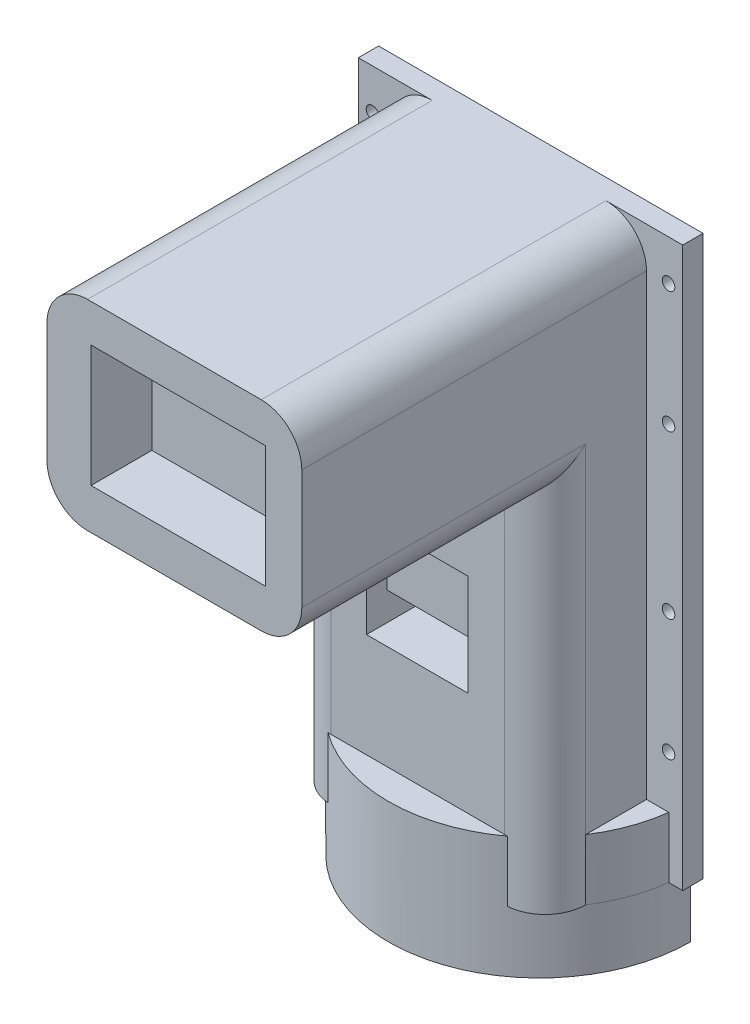
from build123d import *

# Parameters (mm, degrees)
SKETCH_1_W           = 80
SKETCH_1_H           = 156.363783163
EXTRUDE_1_DEPTH      = 90
SKETCH_3_W           = 30
SKETCH_3_H           = 30
CUT_EXTRUDE_1_DEPTH  = 15
SKETCH_4_W           = 182.158516052
SKETCH_4_H           = 121.356957168
CUT_EXTRUDE_2_DEPTH  = 60
SKETCH_6_W           = 50.175493085
SKETCH_6_H           = 149.046749465
CUT_EXTRUDE_4_DEPTH  = 16
SKETCH_7_W           = 13.065428471
SKETCH_7_H           = 30
CUT_EXTRUDE_5_DEPTH  = 147.711160425
SKETCH_8_W           = 28.25361391
SKETCH_8_H           = 169.077909422
CUT_EXTRUDE_6_DEPTH  = 85
SKETCH_10_W          = 25
SKETCH_10_H          = 25
CUT_EXTRUDE_7_DEPTH  = 5
SKETCH_11_W          = 25
SKETCH_11_H          = 7.062774738
CUT_EXTRUDE_8_DEPTH  = 133.850158424
SKETCH_12_R          = 1.553167794
CUT_EXTRUDE_9_DEPTH  = 144.698171851
FILLET_3_R           = 10
CUT_EXTRUDE_START    = 60
SKETCH_15_W          = 25.147195628
SKETCH_15_H          = 171.888478346
CUT_EXTRUDE_10_DEPTH = 85
FILLET_6_R           = 10
FILLET_7_R           = 10
SKETCH_18_W          = 152.348651532
SKETCH_18_H          = 32.578688912
CUT_EXTRUDE_11_DEPTH = 147.711160425
SKETCH_19_R          = 37.254412131
SKETCH_19_R_2        = 32.5
EXTRUDE_3_DEPTH      = 15
SKETCH_20_W          = 127.729938291
SKETCH_20_H          = 42.54840274
CUT_EXTRUDE_12_DEPTH = 185.159311294
EXTRUDE_5_DEPTH      = 15
EXTRUDE_START        = 15
EXTRUDE_6_DEPTH      = 15
EXTRUDE_7_DEPTH      = 15
SKETCH_27_R          = 1.5
CUT_EXTRUDE_13_DEPTH = 10


with BuildPart() as part:
    # 草图1 → 凸台-拉伸1 (new body)
    with BuildSketch(Plane.XY):
        with Locations((-9.441340782, -26.602259963)):
            Rectangle(SKETCH_1_W, SKETCH_1_H)
    extrude(amount=EXTRUDE_1_DEPTH)

    # 草图3 → 切除-拉伸1 (cut)
    with BuildSketch(Plane.XY.offset(90)):
        with Locations((-15.348450006, 27.268684522)):
            Rectangle(SKETCH_3_W, SKETCH_3_H)
    extrude(amount=-CUT_EXTRUDE_1_DEPTH, mode=Mode.SUBTRACT)

    # 草图4 → 切除-拉伸2 (cut)
    with BuildSketch(Plane.XY.offset(90)):
        with Locations((0, -58.480028538)):
            Rectangle(SKETCH_4_W, SKETCH_4_H)
    extrude(amount=-CUT_EXTRUDE_2_DEPTH, mode=Mode.SUBTRACT)

    # 草图6 → 切除-拉伸4 (cut)
    with BuildSketch(Plane(origin=(0, 0, 0), x_dir=(-1, 0, 0), z_dir=(0, 0, -1))):
        with Locations((9.964306437, -36.113761051)):
            Rectangle(SKETCH_6_W, SKETCH_6_H)
    extrude(amount=-CUT_EXTRUDE_4_DEPTH, mode=Mode.SUBTRACT)

    # 草图7 → 切除-拉伸5 (cut, through all)
    with BuildSketch(Plane.XY.offset(90)):
        with Locations((6.18426423, 27.268684522)):
            Rectangle(SKETCH_7_W, SKETCH_7_H)
    extrude(amount=-CUT_EXTRUDE_5_DEPTH, mode=Mode.SUBTRACT)

    # 草图8 → 切除-拉伸6 (cut)
    with BuildSketch(Plane.XY.offset(90)):
        with Locations((-55.342514846, -28.081506765)):
            Rectangle(SKETCH_8_W, SKETCH_8_H)
    extrude(amount=-CUT_EXTRUDE_6_DEPTH, mode=Mode.SUBTRACT)

    # 草图10 → 切除-拉伸7 (cut)
    with BuildSketch(Plane.XY.offset(30)):
        with Locations((-9.930002564, -33.110581364)):
            Rectangle(SKETCH_10_W, SKETCH_10_H)
    extrude(amount=-CUT_EXTRUDE_7_DEPTH, mode=Mode.SUBTRACT)

    # 草图11 → 切除-拉伸8 (cut, through all)
    with BuildSketch(Plane.XY.offset(25)):
        with Locations((-9.930002564, -42.079193995)):
            Rectangle(SKETCH_11_W, SKETCH_11_H)
    extrude(amount=-CUT_EXTRUDE_8_DEPTH, mode=Mode.SUBTRACT)

    # 草图12 → 切除-拉伸9 (cut, through all)
    with BuildSketch(Plane.XY.offset(5)):
        with Locations((-45.941340782, 41.579631618)):
            Circle(SKETCH_12_R)
        with Locations((27.058659218, 41.579631618)):
            Circle(SKETCH_12_R)
        with Locations((-45.941340782, 11.579631618)):
            Circle(SKETCH_12_R)
        with Locations((-45.941340782, -28.420368382)):
            Circle(SKETCH_12_R)
        with Locations((27.058659218, 11.579631618)):
            Circle(SKETCH_12_R)
        with Locations((27.058659218, -28.420368382)):
            Circle(SKETCH_12_R)
        with Locations((-45.941340782, -58.420368382)):
            Circle(SKETCH_12_R)
        with Locations((27.058659218, -58.420368382)):
            Circle(SKETCH_12_R)
    extrude(amount=-CUT_EXTRUDE_9_DEPTH, mode=Mode.SUBTRACT)

    # 圆角3
    fillet_3_edges = [part.edges().sort_by_distance(p)[0] for p in [
        (-41.215707891, -51.292850749, 30),
    ]]
    fillet(fillet_3_edges, radius=FILLET_3_R)

    # 草图15 → 切除-拉伸10 (cut)
    with BuildSketch(Plane.XY.offset(30).offset(CUT_EXTRUDE_START)):
        with Locations((34.196439865, -22.534331259)):
            Rectangle(SKETCH_15_W, SKETCH_15_H)
    extrude(amount=-CUT_EXTRUDE_10_DEPTH, mode=Mode.SUBTRACT)

    # 圆角6
    fillet_6_edges = [part.edges().sort_by_distance(p)[0] for p in [
        (21.622842051, -51.292850749, 30),
    ]]
    fillet(fillet_6_edges, radius=FILLET_6_R)

    # 圆角7
    fillet_7_edges = [part.edges().sort_by_distance(p)[0] for p in [
        (21.622842051, 2.198450046, 55),
        (-41.215707891, 2.198450046, 55),
        (-41.215707891, 51.579631618, 47.5),
        (21.622842051, 51.579631618, 47.5),
    ]]
    fillet(fillet_7_edges, radius=FILLET_7_R)

    # 草图18 → 切除-拉伸11 (cut, through all)
    with BuildSketch(Plane(origin=(0, 0, 0), x_dir=(-1, 0, 0), z_dir=(0, 0, -1))):
        with Locations((19.986133812, -102.5828817)):
            Rectangle(SKETCH_18_W, SKETCH_18_H)
    extrude(amount=-CUT_EXTRUDE_11_DEPTH, mode=Mode.SUBTRACT)

    # 草图19 → 凸台-拉伸3 (add)
    with BuildSketch(Plane.XZ.offset(86.293537244)):
        with Locations(Location((-9.79643292, 0, 0), (0, 0, 126.427336474))):
            Circle(SKETCH_19_R)
        with Locations(Location((-9.79643292, 0, 0), (0, 0, 112.619864948))):
            Circle(SKETCH_19_R_2, mode=Mode.SUBTRACT)
    extrude(amount=EXTRUDE_3_DEPTH)

    # 草图20 → 切除-拉伸12 (cut, through all)
    with BuildSketch(Plane.XZ.offset(101.293537244)):
        with Locations((-5.047238287, -21.27420137)):
            Rectangle(SKETCH_20_W, SKETCH_20_H)
    extrude(amount=-CUT_EXTRUDE_12_DEPTH, mode=Mode.SUBTRACT)

    # 草图24 → 凸台-拉伸5 (add)
    with BuildSketch(Plane(origin=(0, -86.293537244, 0), x_dir=(1, 0, 0), z_dir=(0, 1, 0))):
        with BuildLine():
            Line((-46.713789586, -5), (-41.215707891, -5))
            Line((-41.215707891, -5), (-41.215707891, -20))
            ThreePointArc((-41.215707891, -20), (-44.727814177, -12.779693075), (-46.713789586, -5))
        make_face()
    extrude(amount=EXTRUDE_5_DEPTH)

    # 草图25 → 凸台-拉伸6 (add)
    with BuildSketch(Plane(origin=(0, -86.293537244, 0), x_dir=(1, 0, 0), z_dir=(0, 1, 0)).offset(EXTRUDE_START)):
        with BuildLine():
            Line((-31.918208762, -29.975294107), (12.325342922, -29.975294107))
            ThreePointArc((12.325342922, -29.975294107), (-9.79643292, -37.254412131), (-31.918208762, -29.975294107))
        make_face()
    extrude(amount=-EXTRUDE_6_DEPTH)

    # 草图26 → 凸台-拉伸7 (add)
    with BuildSketch(Plane(origin=(0, -86.293537244, 0), x_dir=(1, 0, 0), z_dir=(0, 1, 0))):
        with BuildLine():
            Line((27.120923747, -5), (21.622842051, -5))
            Line((21.622842051, -5), (21.622842051, -20))
            ThreePointArc((21.622842051, -20), (25.233426536, -12.815789153), (27.120923747, -5))
        make_face()
    extrude(amount=EXTRUDE_7_DEPTH)

    # 草图27 → 切除-拉伸13 (cut)
    with BuildSketch(Plane.XY.offset(25)):
        with Locations((-4.675690362, -23.954796266)):
            Circle(SKETCH_27_R)
        with Locations((-14.675690362, -23.954796266)):
            Circle(SKETCH_27_R)
    extrude(amount=-CUT_EXTRUDE_13_DEPTH, mode=Mode.SUBTRACT)


solid = part.part
